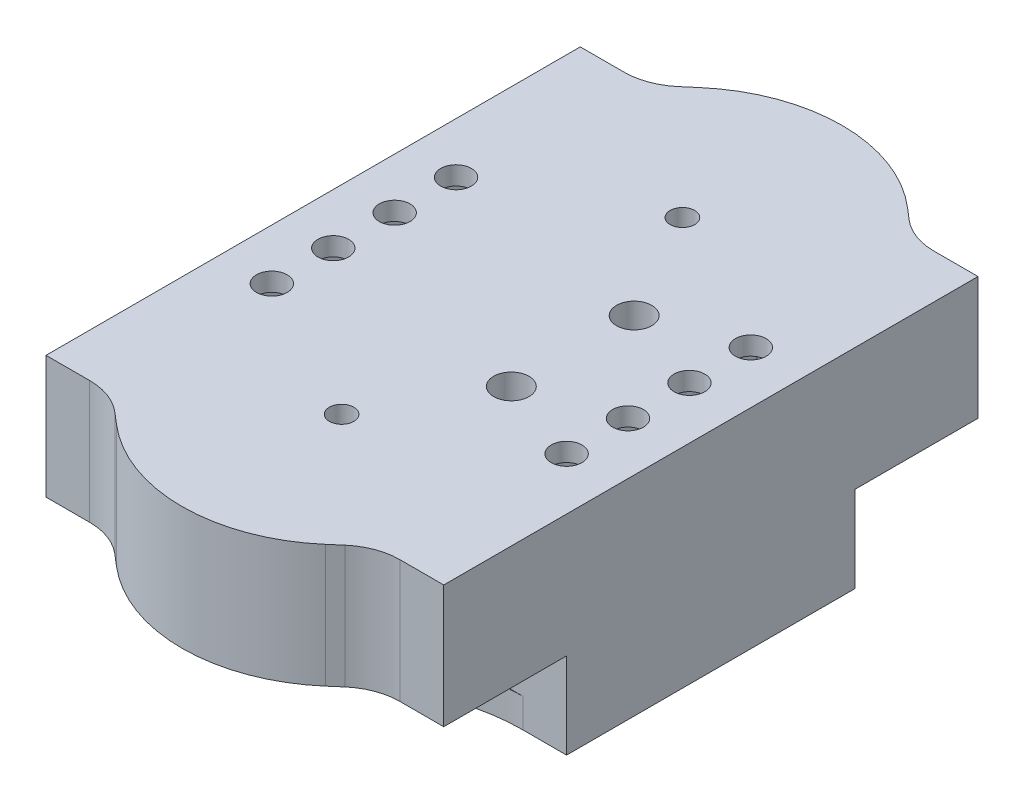
from build123d import *

# Parameters (mm, degrees)
SKETCH2_R           = 2.5
BOSS_EXTRUDE1_DEPTH = 3
BOSS_EXTRUDE2_DEPTH = 20
SKETCH4_R           = 2
BOSS_EXTRUDE3_DEPTH = 20
SKETCH6_R           = 4
BOSS_EXTRUDE5_DEPTH = 14
SKETCH7_W           = 28.258698574
SKETCH7_H           = 15
CUT_EXTRUDE1_DEPTH  = 9.25
FILLET1_R           = 30
SKETCH13_W          = 40
SKETCH13_H          = 40
BOSS_EXTRUDE8_DEPTH = 34
SKETCH14_R          = 2.875
CUT_EXTRUDE4_DEPTH  = 65.233633019
BOSS_EXTRUDE9_DEPTH = 20


with BuildPart() as part:
    # Sketch2 → Boss-Extrude1 (new body)
    with BuildSketch(Plane(origin=(0, 0, 0), x_dir=(1, 0, 0), z_dir=(0, 1, 0))):
        Polygon((-28, -11.5), (-20, -11.5), (-20, 10), (20, 10), (20, -11.5), (28, -11.5), (28, 11.5), (-28, 11.5), align=None)
        with Locations(Location((-24, 5, 0), (0, 0, 270))):
            Circle(SKETCH2_R, mode=Mode.SUBTRACT)
        with Locations(Location((-24, -5, 0), (0, 0, 90))):
            Circle(SKETCH2_R, mode=Mode.SUBTRACT)
        with Locations(Location((24, -5, 0), (0, 0, 270))):
            Circle(SKETCH2_R, mode=Mode.SUBTRACT)
        with Locations(Location((24, 5, 0), (0, 0, 90))):
            Circle(SKETCH2_R, mode=Mode.SUBTRACT)
    boss_extrude1 = extrude(amount=BOSS_EXTRUDE1_DEPTH)

    # Sketch3 → Boss-Extrude2 (add)
    with BuildSketch(Plane(origin=(0, 3, 0), x_dir=(1, 0, 0), z_dir=(0, 1, 0))):
        Polygon((-32.277683008, 10.5), (-32.277683008, -11.5), (-28, -11.5), (-28, 11.5), (28, 11.5), (28, -11.5), (32.493544997, -11.5), (32.493544997, 10.5), (32.493544997, 13.500761643), (-32.277683008, 13.500761643), align=None)
    boss_extrude2 = extrude(amount=-BOSS_EXTRUDE2_DEPTH)

    # Sketch4 → Boss-Extrude3 (add)
    with BuildSketch(Plane(origin=(0, 3, 0), x_dir=(1, 0, 0), z_dir=(0, 1, 0))):
        with BuildLine():
            Line((-3.795424266, 22.307494871), (-16.411972775, 11.5))
            Line((-16.411972775, 11.5), (16.493090482, 11.5))
            Line((16.493090482, 11.5), (4.035447529, 22.286686452))
            ThreePointArc((4.035447529, 22.286686452), (0.123874312, 23.75074046), (-3.795424266, 22.307494871))
        make_face()
        with Locations(Location((0.107930995, 17.750761643, 0), (0, 0, 270))):
            Circle(SKETCH4_R, mode=Mode.SUBTRACT)
    boss_extrude3 = extrude(amount=-BOSS_EXTRUDE3_DEPTH)

    # Sketch6 → Boss-Extrude5 (add)
    with BuildSketch(Plane.XZ.offset(17)):
        with BuildLine():
            Line((28, 11.5), (28, -11.5))
            Line((28, -11.5), (-28, -11.5))
            Line((-28, -11.5), (-28, 11.5))
            Line((-28, 11.5), (-32.277683008, 11.5))
            Line((-32.277683008, 11.5), (-32.277683008, -13.500761643))
            Line((-32.277683008, -13.500761643), (-14.076306034, -13.500761643))
            Line((-14.076306034, -13.500761643), (-3.795424266, -22.307494871))
            ThreePointArc((-3.795424266, -22.307494871), (0.123874312, -23.75074046), (4.035447529, -22.286686452))
            Line((4.035447529, -22.286686452), (14.18239254, -13.500761643))
            Line((14.18239254, -13.500761643), (32.493544997, -13.500761643))
            Line((32.493544997, -13.500761643), (32.493544997, 11.5))
            Line((32.493544997, 11.5), (28, 11.5))
        make_face()
        with Locations(Location((0.107930995, -17.750761643, 0), (0, 0, 270))):
            Circle(SKETCH6_R, mode=Mode.SUBTRACT)
    boss_extrude5 = extrude(amount=BOSS_EXTRUDE5_DEPTH)

    # Sketch7 → Cut-Extrude1 (cut)
    with BuildSketch(Plane(origin=(0, -17, 0), x_dir=(-1, 0, 0), z_dir=(0, -1, 0))):
        with Locations((-0.053043253, 19)):
            Rectangle(SKETCH7_W, SKETCH7_H)
    cut_extrude1 = extrude(amount=CUT_EXTRUDE1_DEPTH, mode=Mode.SUBTRACT)

    # Mirror1: Boss-Extrude1, Boss-Extrude2, Boss-Extrude3, Boss-Extrude5, Cut-Extrude1 across plane
    add(boss_extrude1.mirror(Plane.XY.offset(10)))
    add(boss_extrude2.mirror(Plane.XY.offset(10)))
    add(boss_extrude3.mirror(Plane.XY.offset(10)))
    add(boss_extrude5.mirror(Plane.XY.offset(10)))
    add(cut_extrude1.mirror(Plane.XY.offset(10)), mode=Mode.SUBTRACT)

    # Fillet1
    fillet1_edges = [part.edges().sort_by_distance(p)[0] for p in [
        (14.18239254, -28.625, -13.500761643),
        (-14.076306034, -7, -13.500761643),
        (14.18239254, -28.625, 33.500761643),
        (-14.076306034, -7, 33.500761643),
        (14.18239254, -7, 33.500761643),
        (-14.076306034, -28.625, 33.500761643),
        (-14.076306034, -28.625, -13.500761643),
        (14.18239254, -7, -13.500761643),
    ]]
    fillet(fillet1_edges, radius=FILLET1_R)

    # Sketch13 → Boss-Extrude8 (add)
    with BuildSketch(Plane(origin=(0, 3, 0), x_dir=(1, 0, 0), z_dir=(0, 1, 0))):
        with Locations((0, -10)):
            Rectangle(SKETCH13_W, SKETCH13_H)
    extrude(amount=-BOSS_EXTRUDE8_DEPTH)

    # Sketch14 → Cut-Extrude4 (cut, through all)
    with BuildSketch(Plane(origin=(0, 3, 0), x_dir=(1, 0, 0), z_dir=(0, 1, 0))):
        with Locations(Location((10, 0, 0), (0, 0, 270))):
            Circle(SKETCH14_R)
        with Locations(Location((10, -20, 0), (0, 0, 270))):
            Circle(SKETCH14_R)
    extrude(amount=-CUT_EXTRUDE4_DEPTH, mode=Mode.SUBTRACT)

    # Sketch15 → Boss-Extrude9 (add)
    with BuildSketch(Plane(origin=(0, 3, 0), x_dir=(1, 0, 0), z_dir=(0, 1, 0))):
        with BuildLine():
            ThreePointArc((25.365605991, -53.500761643), (21.872666456, -54.130629658), (18.8197451, -55.940886962))
            Line((18.8197451, -55.940886962), (17.127169311, -57.406435814))
            ThreePointArc((17.127169311, -57.406435814), (0.177018704, -63.750669852), (-16.806608467, -57.496605631))
            Line((-16.806608467, -57.496605631), (-18.663222883, -55.906206263))
            ThreePointArc((-18.663222883, -55.906206263), (-21.700786279, -54.121381232), (-25.168814984, -53.500761643))
            Line((-25.168814984, -53.500761643), (-32.277683008, -53.500761643))
            Line((-32.277683008, -53.500761643), (-32.277683008, -33.500761643))
            Line((-32.277683008, -33.500761643), (-25.168814984, -33.500761643))
            ThreePointArc((-25.168814984, -33.500761643), (-14.764728868, -35.362620409), (-5.652038682, -40.717095502))
            Line((-5.652038682, -40.717095502), (-3.795424266, -42.307494871))
            ThreePointArc((-3.795424266, -42.307494871), (0.123874312, -43.75074046), (4.035447529, -42.286686452))
            Line((4.035447529, -42.286686452), (5.728023318, -40.821137599))
            ThreePointArc((5.728023318, -40.821137599), (14.886787387, -35.39036569), (25.365605991, -33.500761643))
            Line((25.365605991, -33.500761643), (32.493544997, -33.500761643))
            Line((32.493544997, -33.500761643), (32.493544997, -53.500761643))
            Line((32.493544997, -53.500761643), (25.365605991, -53.500761643))
        make_face()
        with BuildLine():
            ThreePointArc((18.8197451, 35.940886962), (21.872666456, 34.130629658), (25.365605991, 33.500761643))
            Line((25.365605991, 33.500761643), (32.493544997, 33.500761643))
            Line((32.493544997, 33.500761643), (32.493544997, 13.500761643))
            Line((32.493544997, 13.500761643), (25.365605991, 13.500761643))
            ThreePointArc((25.365605991, 13.500761643), (14.886787387, 15.39036569), (5.728023318, 20.821137599))
            Line((5.728023318, 20.821137599), (4.035447529, 22.286686452))
            ThreePointArc((4.035447529, 22.286686452), (0.123874312, 23.75074046), (-3.795424266, 22.307494871))
            Line((-3.795424266, 22.307494871), (-5.652038682, 20.717095502))
            ThreePointArc((-5.652038682, 20.717095502), (-14.764728868, 15.362620409), (-25.168814984, 13.500761643))
            Line((-25.168814984, 13.500761643), (-32.277683008, 13.500761643))
            Line((-32.277683008, 13.500761643), (-32.277683008, 33.500761643))
            Line((-32.277683008, 33.500761643), (-25.168814984, 33.500761643))
            ThreePointArc((-25.168814984, 33.500761643), (-21.700786279, 34.121381232), (-18.663222883, 35.906206263))
            Line((-18.663222883, 35.906206263), (-16.806608467, 37.496605631))
            ThreePointArc((-16.806608467, 37.496605631), (0.177018704, 43.750669852), (17.127169311, 37.406435814))
            Line((17.127169311, 37.406435814), (18.8197451, 35.940886962))
        make_face()
    extrude(amount=-BOSS_EXTRUDE9_DEPTH)


solid = part.part
